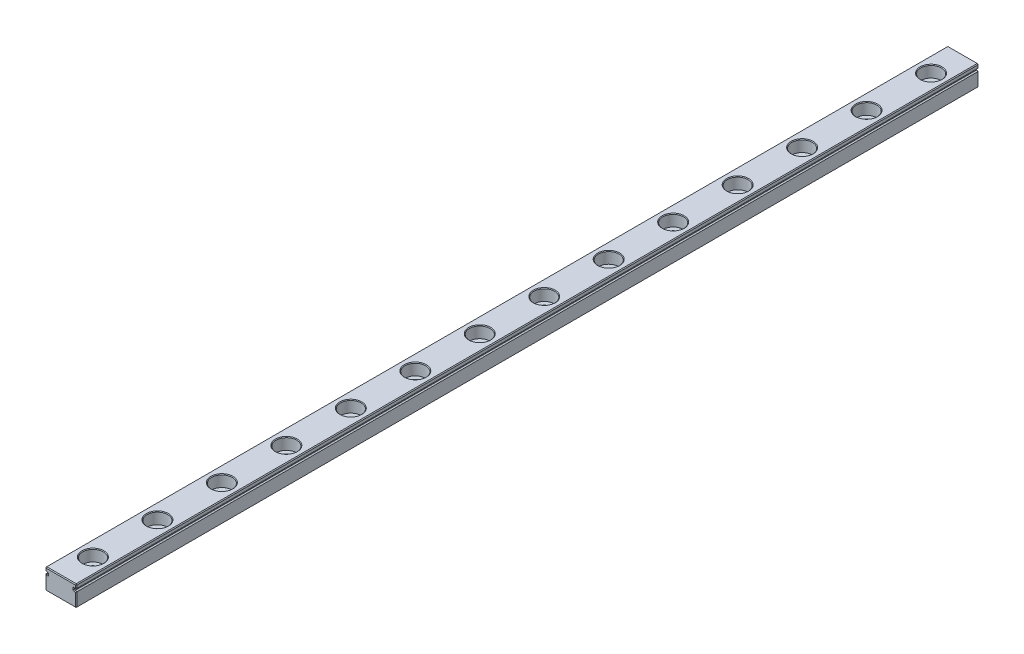
from build123d import *

# Parameters (mm, degrees)
BOSS_EXTRUDE1_DEPTH = 350
CHAMFER1_SIZE       = 0.3
LPATTERN1_COUNT     = 14
LPATTERN1_PITCH     = 25


with BuildPart() as part:
    # Sketch1 → Boss-Extrude1 (new body)
    with BuildSketch(Plane.XY):
        with BuildLine():
            Line((0, 8), (12, 8))
            Line((12, 8), (12, 6.75))
            Line((12, 6.75), (12, 6.559016994))
            ThreePointArc((12, 6.559016994), (11.706107374, 6.475528258), (11.5, 6.25))
            Line((11.5, 6.25), (11, 6.25))
            Line((11, 6.25), (11, 5.75))
            Line((11, 5.75), (11.5, 5.75))
            ThreePointArc((11.5, 5.75), (11.706107374, 5.524471742), (12, 5.440983006))
            Line((12, 5.440983006), (12, 5.25))
            Line((12, 5.25), (12, 0))
            Line((12, 0), (0, 0))
            Line((0, 0), (0, 5.25))
            Line((0, 5.25), (0, 5.440983006))
            ThreePointArc((0, 5.440983006), (0.293892626, 5.524471742), (0.5, 5.75))
            Line((0.5, 5.75), (1, 5.75))
            Line((1, 5.75), (1, 6.25))
            Line((1, 6.25), (0.5, 6.25))
            ThreePointArc((0.5, 6.25), (0.293892626, 6.475528258), (0, 6.559016994))
            Line((0, 6.559016994), (0, 6.75))
            Line((0, 6.75), (0, 8))
        make_face()
    extrude(amount=BOSS_EXTRUDE1_DEPTH)

    # Chamfer1
    chamfer1_edges = [part.edges().sort_by_distance(p)[0] for p in [
        (12, 2.720491503, 350),
        (11.706107374, 5.524471742, 350),
        (0, 2.720491503, 0),
        (0.293892626, 5.524471742, 0),
        (0.75, 5.75, 0),
        (1, 6, 0),
        (0.75, 6.25, 0),
        (11.25, 5.75, 350),
        (0.293892626, 6.475528258, 0),
        (0, 7.279508497, 0),
        (6, 8, 0),
        (12, 7.279508497, 0),
        (11.706107374, 6.475528258, 0),
        (11, 6, 350),
        (11.25, 6.25, 0),
        (11, 6, 0),
        (11.25, 5.75, 0),
        (11.706107374, 5.524471742, 0),
        (12, 2.720491503, 0),
        (6, 0, 0),
        (11.25, 6.25, 350),
        (11.706107374, 6.475528258, 350),
        (12, 7.279508497, 350),
        (0, 8, 175),
        (12, 8, 175),
        (12, 0, 175),
        (0, 0, 175),
        (6, 8, 350),
        (0, 2.720491503, 350),
        (0, 7.279508497, 350),
        (0.293892626, 6.475528258, 350),
        (0.75, 6.25, 350),
        (1, 6, 350),
        (0.75, 5.75, 350),
        (0.293892626, 5.524471742, 350),
        (6, 0, 350),
    ]]
    chamfer(chamfer1_edges, length=CHAMFER1_SIZE)

    # Sketch3 → CBORE for M5 Hex Head Bolt1 (revolve, cut)
    with BuildSketch(Plane(origin=(6, 8, 12.5), x_dir=(0, 0, 1), z_dir=(1, 0, 0))):
        Polygon((0, 0), (0, 8), (2.5, 8), (2.25, 7.75), (2.25, 4.5), (4, 4.5), (4, 0.25), (4.25, 0), align=None)
    cbore_for_m5_hex_head_bolt1 = revolve(axis=Axis((6, 14.35, 12.5), (0, -1, 0)), mode=Mode.SUBTRACT)

    # LPattern1: CBORE for M5 Hex Head Bolt1 ×14
    with Locations(*[(0, 0, i * LPATTERN1_PITCH) for i in range(1, LPATTERN1_COUNT)]):
        add(cbore_for_m5_hex_head_bolt1, mode=Mode.SUBTRACT)


solid = part.part
